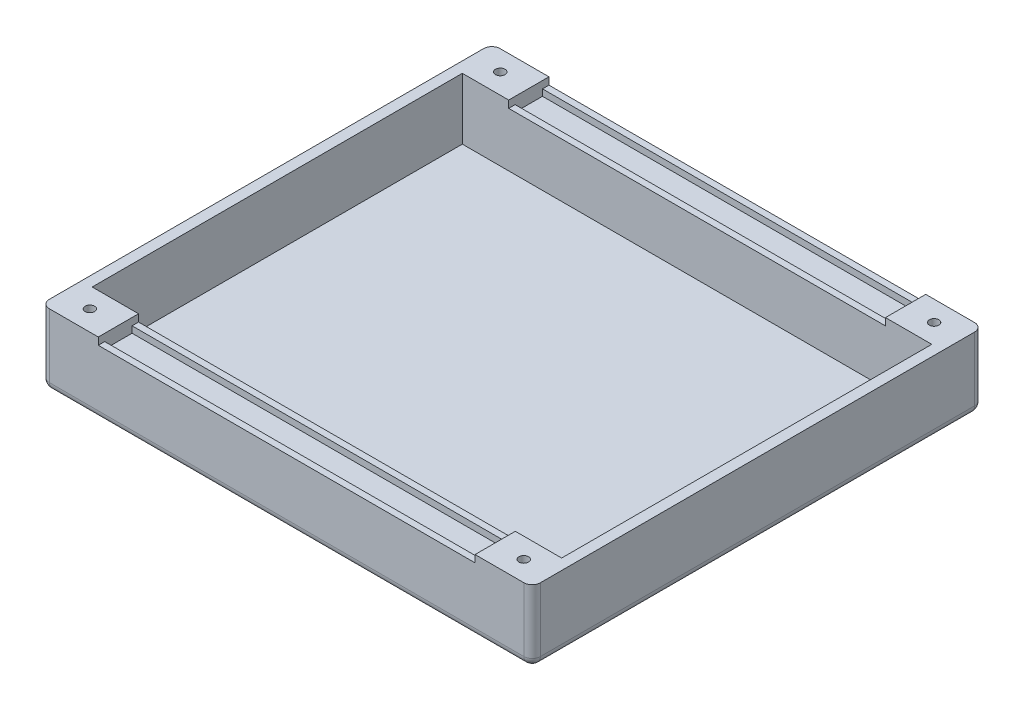
from build123d import *

# Parameters (mm, degrees)
SKETCH1_W           = 228.04
SKETCH1_H           = 209.32
BOSS_EXTRUDE1_DEPTH = 33.5
SKETCH2_W           = 218.04
SKETCH2_H           = 171.92
CUT_EXTRUDE1_DEPTH  = 28.5
SKETCH4_W           = 175
SKETCH4_H           = 18.7
CUT_EXTRUDE2_DEPTH  = 3.35
SKETCH5_W           = 175
SKETCH5_H           = 12.7
CUT_EXTRUDE3_DEPTH  = 3
SKETCH6_W           = 175
SKETCH6_H           = 18.7
CUT_EXTRUDE4_DEPTH  = 3.35
SKETCH7_W           = 175
SKETCH7_H           = 12.7
CUT_EXTRUDE5_DEPTH  = 3
SKETCH11_R          = 2.2
CUT_EXTRUDE6_DEPTH  = 33.5
FILLET3_R           = 3.81


with BuildPart() as part:
    # Sketch1 → Boss-Extrude1 (new body)
    with BuildSketch(Plane(origin=(0, 0, 0), x_dir=(1, 0, 0), z_dir=(0, 1, 0))):
        Rectangle(SKETCH1_W, SKETCH1_H)
    extrude(amount=BOSS_EXTRUDE1_DEPTH)

    # Sketch2 → Cut-Extrude1 (cut)
    with BuildSketch(Plane(origin=(0, 33.5, 0), x_dir=(1, 0, 0), z_dir=(0, 1, 0))):
        Rectangle(SKETCH2_W, SKETCH2_H)
    extrude(amount=-CUT_EXTRUDE1_DEPTH, mode=Mode.SUBTRACT)

    # Sketch4 → Cut-Extrude2 (cut)
    with BuildSketch(Plane(origin=(0, 33.5, 0), x_dir=(1, 0, 0), z_dir=(0, 1, 0))):
        with Locations((0, -95.31)):
            Rectangle(SKETCH4_W, SKETCH4_H)
    extrude(amount=-CUT_EXTRUDE2_DEPTH, mode=Mode.SUBTRACT)

    # Sketch5 → Cut-Extrude3 (cut)
    with BuildSketch(Plane(origin=(0, 30.15, 0), x_dir=(1, 0, 0), z_dir=(0, 1, 0))):
        with Locations((0, -95.31)):
            Rectangle(SKETCH5_W, SKETCH5_H)
    extrude(amount=-CUT_EXTRUDE3_DEPTH, mode=Mode.SUBTRACT)

    # Sketch6 → Cut-Extrude4 (cut)
    with BuildSketch(Plane(origin=(0, 33.5, 0), x_dir=(1, 0, 0), z_dir=(0, 1, 0))):
        with Locations((0, 95.31)):
            Rectangle(SKETCH6_W, SKETCH6_H)
    extrude(amount=-CUT_EXTRUDE4_DEPTH, mode=Mode.SUBTRACT)

    # Sketch7 → Cut-Extrude5 (cut)
    with BuildSketch(Plane(origin=(0, 30.15, 0), x_dir=(1, 0, 0), z_dir=(0, 1, 0))):
        with Locations((0, 95.31)):
            Rectangle(SKETCH7_W, SKETCH7_H)
    extrude(amount=-CUT_EXTRUDE5_DEPTH, mode=Mode.SUBTRACT)

    # Sketch11 → Cut-Extrude6 (cut)
    with BuildSketch(Plane(origin=(0, 33.5, 0), x_dir=(1, 0, 0), z_dir=(0, 1, 0))):
        with Locations(Location((100.76, 95.31, 0), (0, 0, 270))):
            Circle(SKETCH11_R)
        with Locations(Location((100.76, -95.31, 0), (0, 0, 90))):
            Circle(SKETCH11_R)
    cut_extrude6 = extrude(amount=-CUT_EXTRUDE6_DEPTH, mode=Mode.SUBTRACT)

    # Fillet3
    fillet3_edges = [part.edges().sort_by_distance(p)[0] for p in [
        (0, 0, 104.66),
        (-114.02, 0, 0),
        (0, 0, -104.66),
        (114.02, 0, 0),
        (114.02, 16.75, 104.66),
        (-114.02, 16.75, 104.66),
        (-114.02, 16.75, -104.66),
        (114.02, 16.75, -104.66),
    ]]
    fillet(fillet3_edges, radius=FILLET3_R)

    # Mirror1: Cut-Extrude6 across plane
    add(cut_extrude6.mirror(Plane.ZY), mode=Mode.SUBTRACT)


solid = part.part
